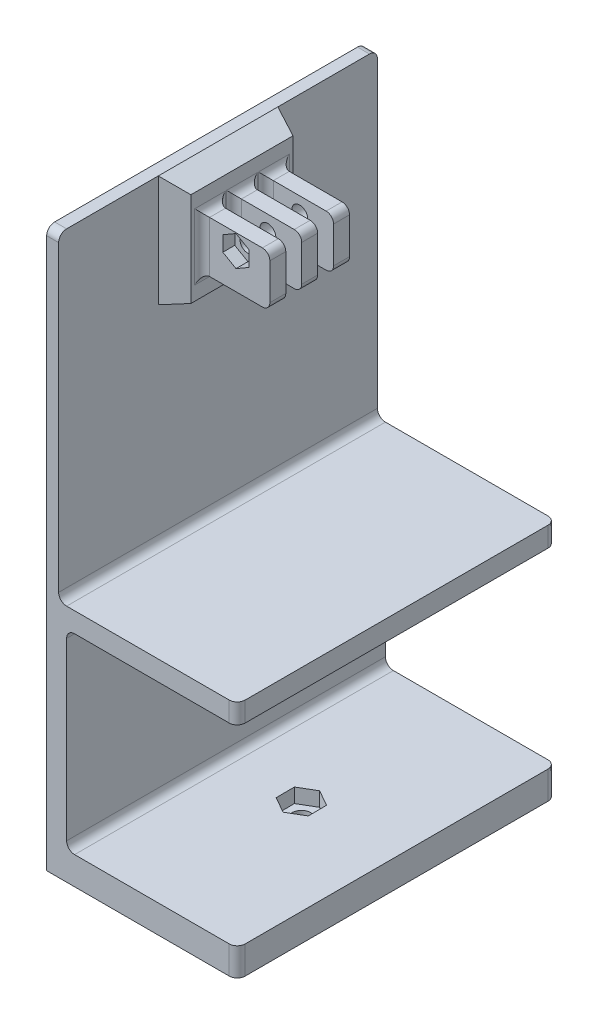
from build123d import *

# Parameters (mm, degrees)
BOSS_EXTRUDE1_DEPTH            = 101.6
CUT_EXTRUDE2_REACH             = 142.769
SKETCH2_R                      = 2.9845
CUT_EXTRUDE2_DIRECTION_2_DEPTH = 141.768746531
SKETCH8_W                      = 3.81
SKETCH8_H                      = 101.6
BOSS_EXTRUDE3_DEPTH            = 101.6
CUT_EXTRUDE5_DEPTH             = 4.572
SKETCH24_W                     = 38.1
SKETCH24_H                     = 35.56
BOSS_EXTRUDE8_DEPTH            = 7.62
BOSS_EXTRUDE8_TAPER            = 20
SKETCH29_W                     = 5.08
SKETCH29_H                     = 16.309015266
BOSS_EXTRUDE10_DEPTH           = 21.59
CUT_EXTRUDE8_DEPTH             = 199.322792527
CUT_EXTRUDE8_DEPTH_BACK        = 199.322792527
SKETCH30_R                     = 2.54
FILLET8_R                      = 2.38
CUT_EXTRUDE9_DEPTH             = 3.81
FILLET9_R                      = 2.54


with BuildPart() as part:
    # Sketch1 → Boss-Extrude1 (new body)
    with BuildSketch(Plane.XY):
        Polygon((0, 0), (0, 76.2), (60.71935441, 76.2), (60.71935441, 69.85), (6.35, 69.85), (6.35, 8.89), (60.71935441, 8.89), (60.71935441, 0), align=None)
    extrude(amount=BOSS_EXTRUDE1_DEPTH)

    # Sketch2 → Cut-Extrude2 (cut, up to next)
    with BuildSketch(Plane(origin=(0, 0, 0), x_dir=(1, 0, 0), z_dir=(0, 1, 0)), mode=Mode.PRIVATE) as cut_extrude2_sk1:
        with Locations(Location((30.359677205, -50.8, 0), (0, 0, 270))):
            Circle(SKETCH2_R)
    cut_extrude2_tool1 = extrude(cut_extrude2_sk1.sketch, amount=CUT_EXTRUDE2_REACH, mode=Mode.PRIVATE) & part.part
    add(cut_extrude2_tool1.solids().sort_by_distance((30.359677, 0, 50.8))[0], mode=Mode.SUBTRACT)

    # Sketch2 → Cut-Extrude2 direction 2 (cut)
    with BuildSketch(Plane(origin=(0, 0, 0), x_dir=(1, 0, 0), z_dir=(0, 1, 0))):
        with Locations(Location((30.359677205, -50.8, 0), (0, 0, 270))):
            Circle(SKETCH2_R)
    extrude(amount=-CUT_EXTRUDE2_DIRECTION_2_DEPTH, mode=Mode.SUBTRACT)

    # Sketch8 → Boss-Extrude3 (add)
    with BuildSketch(Plane(origin=(0, 76.2, 0), x_dir=(1, 0, 0), z_dir=(0, 1, 0))):
        with Locations((1.905, -50.8)):
            Rectangle(SKETCH8_W, SKETCH8_H)
    extrude(amount=BOSS_EXTRUDE3_DEPTH)

    # Sketch20 → Cut-Extrude5 (cut)
    with BuildSketch(Plane(origin=(0, 8.89, 0), x_dir=(1, 0, 0), z_dir=(0, 1, 0))):
        Polygon((35.462369538, -53.693279158), (35.416676623, -47.827578391), (30.31398429, -44.934299233), (25.256984872, -47.906720842), (25.302677788, -53.772421609), (30.405370121, -56.665700767), align=None)
    extrude(amount=-CUT_EXTRUDE5_DEPTH, mode=Mode.SUBTRACT)

    # Sketch24 → Boss-Extrude8 (add)
    with BuildSketch(Plane(origin=(3.81, 0, 0), x_dir=(0, 0, -1), z_dir=(1, 0, 0))):
        with Locations((-50.8, 160.02)):
            Rectangle(SKETCH24_W, SKETCH24_H)
    extrude(amount=BOSS_EXTRUDE8_DEPTH, taper=BOSS_EXTRUDE8_TAPER)

    # Sketch29 → Boss-Extrude10 (add)
    with BuildSketch(Plane(origin=(11.43, 0, 0), x_dir=(0, 0, -1), z_dir=(1, 0, 0))):
        with Locations((-60.96, 160.02)):
            Rectangle(SKETCH29_W, SKETCH29_H)
        with Locations((-50.8, 160.02)):
            Rectangle(SKETCH29_W, SKETCH29_H)
        with Locations((-40.64, 160.02)):
            Rectangle(SKETCH29_W, SKETCH29_H)
    extrude(amount=BOSS_EXTRUDE10_DEPTH)

    # Sketch30 → Cut-Extrude8 (cut, two sides: drawn at the far end of the back side and taken through both)
    with BuildSketch(Plane.XY.offset(63.5).offset(-CUT_EXTRUDE8_DEPTH_BACK)):
        with Locations(Location((22.225, 163.094507633, 0), (0, 0, 180))):
            Circle(SKETCH30_R)
    extrude(amount=CUT_EXTRUDE8_DEPTH + CUT_EXTRUDE8_DEPTH_BACK, mode=Mode.SUBTRACT)

    # Fillet8
    fillet8_edges = [part.edges().sort_by_distance(p)[0] for p in [
        (33.02, 168.174507633, 40.64),
        (11.43, 160.02, 43.18),
        (11.43, 151.865492367, 40.64),
        (33.02, 151.865492367, 40.64),
        (11.43, 168.174507633, 40.64),
        (11.43, 160.02, 38.1),
        (33.02, 168.174507633, 50.8),
        (11.43, 160.02, 53.34),
        (11.43, 151.865492367, 50.8),
        (33.02, 151.865492367, 50.8),
        (11.43, 168.174507633, 50.8),
        (11.43, 160.02, 48.26),
        (33.02, 168.174507633, 60.96),
        (11.43, 160.02, 63.5),
        (11.43, 151.865492367, 60.96),
        (33.02, 151.865492367, 60.96),
        (11.43, 168.174507633, 60.96),
        (11.43, 160.02, 58.42),
    ]]
    fillet(fillet8_edges, radius=FILLET8_R)

    # Sketch31 → Cut-Extrude9 (cut)
    with BuildSketch(Plane.XY.offset(63.5)):
        Polygon((26.416, 165.514182611), (22.225, 167.93385759), (18.034, 165.514182611), (18.034, 160.674832655), (22.225, 158.255157677), (26.416, 160.674832655), align=None)
    extrude(amount=-CUT_EXTRUDE9_DEPTH, mode=Mode.SUBTRACT)

    # Fillet9
    fillet9_edges = [part.edges().sort_by_distance(p)[0] for p in [
        (60.71935441, 4.445, 0),
        (6.35, 69.85, 50.8),
        (6.35, 8.89, 50.8),
        (60.71935441, 73.025, 101.6),
        (3.81, 76.2, 50.8),
        (1.905, 177.8, 101.6),
        (1.905, 177.8, 0),
        (60.71935441, 4.445, 101.6),
        (60.71935441, 73.025, 0),
    ]]
    fillet(fillet9_edges, radius=FILLET9_R)


solid = part.part
